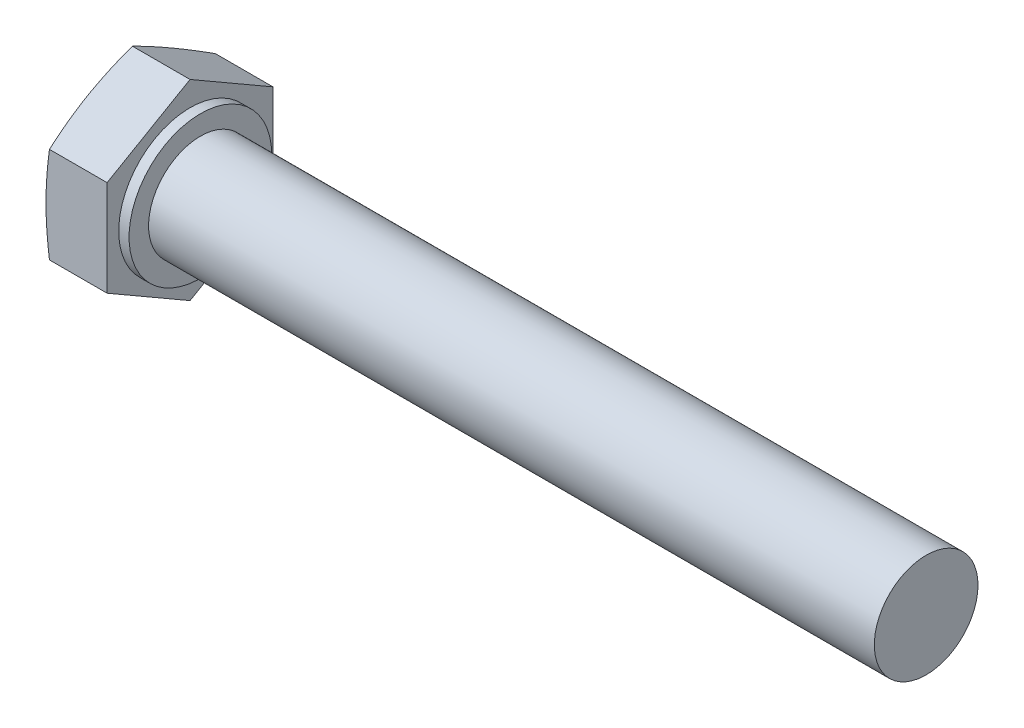
from build123d import *

# Parameters (mm, degrees)
HEAD_DEPTH        = 3.5
SK2_W             = 0.5
SK2_H             = 1.178802154
SK3_R             = 2.5
BODY_DEPTH        = 35
SK5_OUTSIDE_W     = 316.508
SK5_OUTSIDE_H     = 317.746
SK5_OUTSIDE_R     = 3.8
HEADCHAMFER_DEPTH = 39.981833376
HEADCHAMFER_DRAFT = -75


with BuildPart() as part:
    # Sk1 → Head (new body)
    with BuildSketch(Plane(origin=(0, 0, 0), x_dir=(0, 0, -1), z_dir=(1, 0, 0))):
        Polygon((0, 4.618802154), (-4, 2.309401077), (-4, -2.309401077), (0, -4.618802154), (4, -2.309401077), (4, 2.309401077), align=None)
    extrude(amount=-HEAD_DEPTH)

    # Sk2 → UNHead (revolve, cut)
    with BuildSketch(Plane.XY, mode=Mode.PRIVATE) as unhead_sk:
        with Locations((-0.25, 4.029401077)):
            Rectangle(SK2_W, SK2_H)
    revolve(unhead_sk.sketch.rotate(Axis((0, 0, 0), (-1, 0, 0)), 90), axis=Axis((0, 0, 0), (-1, 0, 0)), mode=Mode.SUBTRACT)

    # Sk3 → Body (add)
    with BuildSketch(Plane(origin=(0, 0, 0), x_dir=(0, 0, -1), z_dir=(1, 0, 0))):
        Circle(SK3_R)
    extrude(amount=BODY_DEPTH)


with BuildPart() as headchamfer_tool:
    # Sk5 outside → HeadChamfer (with draft: the straight prism first)
    with BuildSketch(Plane.ZY.offset(3.5)):
        Rectangle(SK5_OUTSIDE_W, SK5_OUTSIDE_H)
        Circle(SK5_OUTSIDE_R, mode=Mode.SUBTRACT)
    extrude(amount=-HEADCHAMFER_DEPTH)
    # HeadChamfer: the draft: its side faces are tilted about the plane it starts from
    headchamfer_sides = [headchamfer_tool.faces().sort_by_distance(p)[0] for p in [
        (16.490916688, -158.873, 0),
        (16.490916688, 0, 158.254),
        (16.490916688, 158.873, 0),
        (16.490916688, 0, -158.254),
        (16.490916688, 0, -3.8),
    ]]
    draft(headchamfer_sides, Plane.ZY.offset(3.5), HEADCHAMFER_DRAFT)


with BuildPart() as part_1:
    add(part.part)

    # HeadChamfer: cut by headchamfer_tool
    add(headchamfer_tool.part, mode=Mode.SUBTRACT)


solid = part_1.part
